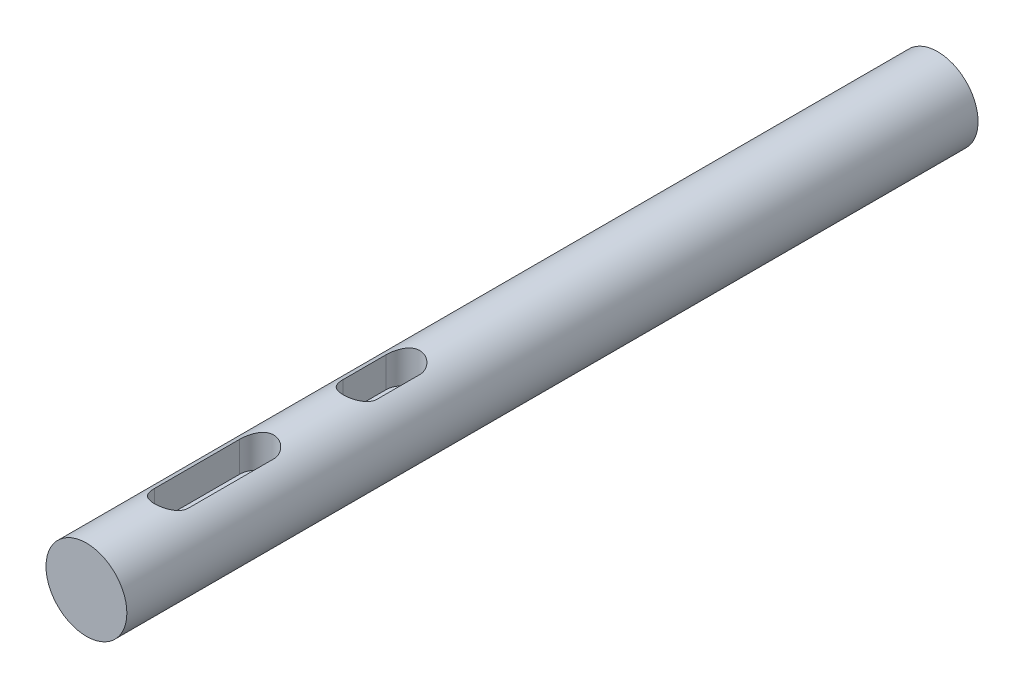
from build123d import *

# Parameters (mm, degrees)
SKETCH1_R           = 4.75
BOSS_EXTRUDE1_DEPTH = 0.0001
BOSS_EXTRUDE2_START = 105
SKETCH4_R           = 4.75
BOSS_EXTRUDE2_DEPTH = 105
CUT_EXTRUDE3_DEPTH  = 4
SKETCH6_R           = 4.75
CUT_EXTRUDE4_DEPTH  = 5


with BuildPart() as part:
    # Sketch1 → Boss-Extrude1 (new body)
    with BuildSketch(Plane.XY):
        Circle(SKETCH1_R)
    extrude(amount=BOSS_EXTRUDE1_DEPTH)

    # Sketch4 → Boss-Extrude2 (add)
    with BuildSketch(Plane(origin=(0, 0, 0), x_dir=(-1, 0, 0), z_dir=(0, 0, -1)).offset(BOSS_EXTRUDE2_START)):
        Circle(SKETCH4_R)
    extrude(amount=-BOSS_EXTRUDE2_DEPTH)

    # Sketch5 → Cut-Extrude3 (cut)
    with BuildSketch(Plane(origin=(0, 4.75, 0), x_dir=(1, 0, 0), z_dir=(0, 1, 0))):
        with BuildLine():
            Line((-2, 10), (-2, 20))
            ThreePointArc((-2, 20), (0, 22), (2, 20))
            Line((2, 20), (2, 10))
            ThreePointArc((2, 10), (0, 8), (-2, 10))
        make_face()
        with BuildLine():
            Line((-2, 32.17), (-2, 37.17))
            ThreePointArc((-2, 37.17), (0, 39.17), (2, 37.17))
            Line((2, 37.17), (2, 32.17))
            ThreePointArc((2, 32.17), (0, 30.17), (-2, 32.17))
        make_face()
    extrude(amount=-CUT_EXTRUDE3_DEPTH, mode=Mode.SUBTRACT)

    # Sketch6 → Cut-Extrude4 (cut)
    with BuildSketch(Plane(origin=(0, 0, -105), x_dir=(-1, 0, 0), z_dir=(0, 0, -1))):
        Circle(SKETCH6_R)
    extrude(amount=-CUT_EXTRUDE4_DEPTH, mode=Mode.SUBTRACT)


solid = part.part
